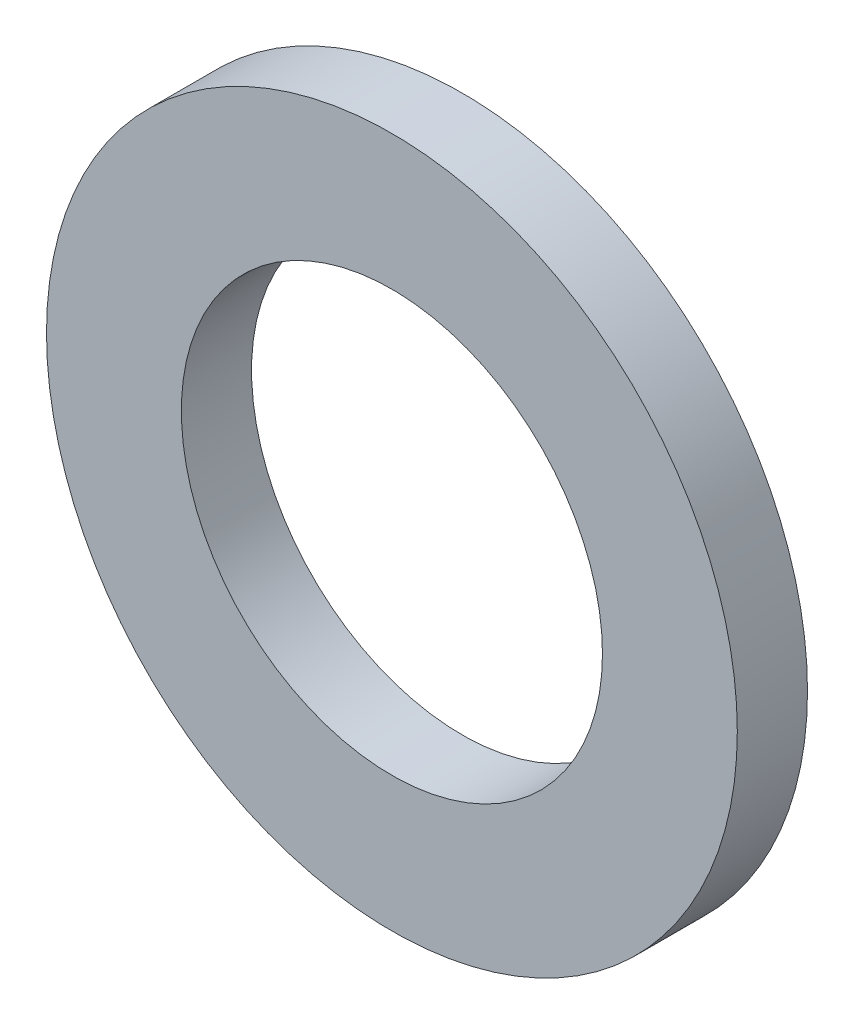
from build123d import *

# Parameters (mm, degrees)
SKETCH1_R      = 2.5
SKETCH1_R_2    = 1.524
EXTRUDE1_DEPTH = 0.508


with BuildPart() as part:
    # Sketch1 → Extrude1 (new body)
    with BuildSketch(Plane.XY):
        Circle(SKETCH1_R)
        Circle(SKETCH1_R_2, mode=Mode.SUBTRACT)
    extrude(amount=-EXTRUDE1_DEPTH)


solid = part.part
